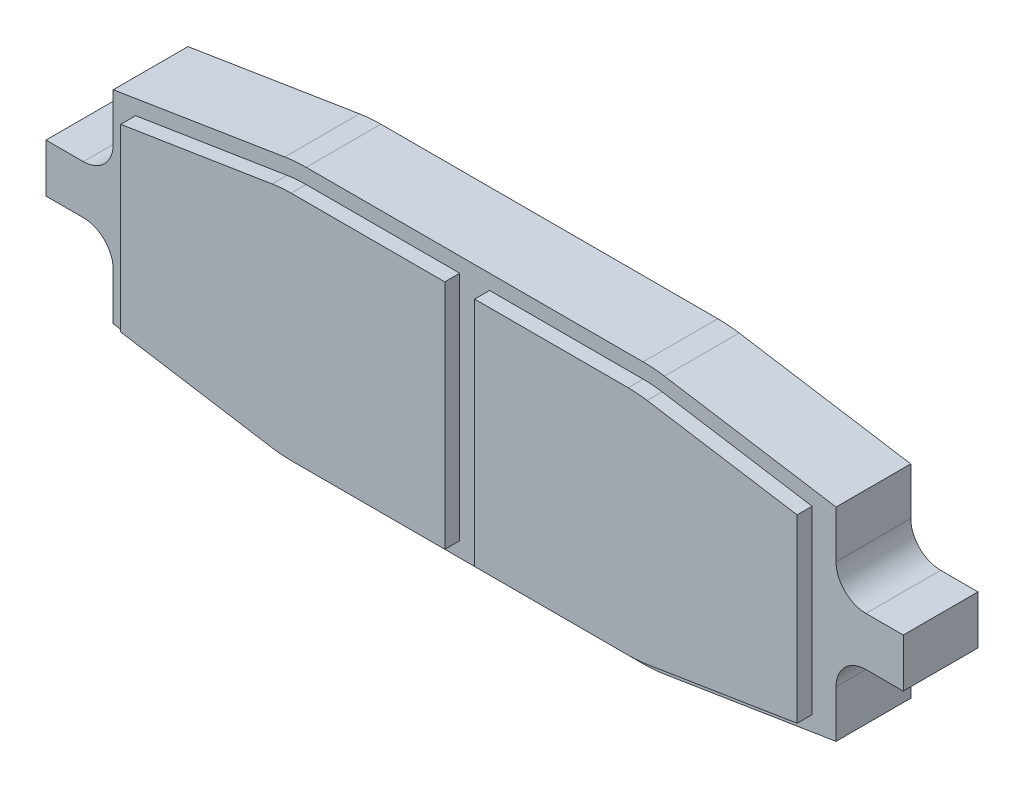
from build123d import *

# Parameters (mm, degrees)
BOSS_EXTRUDE1_DEPTH = 10
BOSS_EXTRUDE2_DEPTH = 2


with BuildPart() as part:
    # Sketch1 → Boss-Extrude1 (new body)
    with BuildSketch(Plane.XY):
        with BuildLine():
            Line((-52.370168415, -5.10038319), (-57.370168415, -5.10038319))
            Line((-57.370168415, -5.10038319), (-57.370168415, 1.39961681))
            Line((-57.370168415, 1.39961681), (-52.370168415, 1.39961681))
            ThreePointArc((-52.370168415, 1.39961681), (-49.54174129, 2.571189685), (-48.370168415, 5.39961681))
            Line((-48.370168415, 5.39961681), (-48.370168415, 11.733421381))
            Line((-48.370168415, 11.733421381), (-25.403732634, 15.421876122))
            ThreePointArc((-25.403732634, 15.421876122), (-23.981138375, 15.592591307), (-22.549472845, 15.64961681))
            Line((-22.549472845, 15.64961681), (22.549472845, 15.64961681))
            ThreePointArc((22.549472845, 15.64961681), (23.981138375, 15.592591307), (25.403732634, 15.421876122))
            Line((25.403732634, 15.421876122), (48.370168415, 11.733421381))
            Line((48.370168415, 11.733421381), (48.370168415, 5.39961681))
            ThreePointArc((48.370168415, 5.39961681), (49.54174129, 2.571189685), (52.370168415, 1.39961681))
            Line((52.370168415, 1.39961681), (57.370168415, 1.39961681))
            Line((57.370168415, 1.39961681), (57.370168415, -5.10038319))
            Line((57.370168415, -5.10038319), (52.370168415, -5.10038319))
            ThreePointArc((52.370168415, -5.10038319), (49.54174129, -6.271956065), (48.370168415, -9.10038319))
            Line((48.370168415, -9.10038319), (48.370168415, -15.434187761))
            Line((48.370168415, -15.434187761), (25.403732634, -19.122642502))
            ThreePointArc((25.403732634, -19.122642502), (23.981138375, -19.293357687), (22.549472845, -19.35038319))
            Line((22.549472845, -19.35038319), (-22.549472845, -19.35038319))
            ThreePointArc((-22.549472845, -19.35038319), (-23.980404824, -19.293416202), (-25.402279482, -19.12287582))
            Line((-25.402279482, -19.12287582), (-48.370168415, -15.398566029))
            Line((-48.370168415, -15.398566029), (-48.370168415, -9.10038319))
            ThreePointArc((-48.370168415, -9.10038319), (-49.54174129, -6.271956065), (-52.370168415, -5.10038319))
        make_face()
    extrude(amount=BOSS_EXTRUDE1_DEPTH)

    # Sketch2 → Boss-Extrude2 (add)
    with BuildSketch(Plane.XY.offset(10)):
        with BuildLine():
            Line((-2, 13.64961681), (-2, -17.35038319))
            Line((-2, -17.35038319), (-22.549472845, -17.35038319))
            ThreePointArc((-22.549472845, -17.35038319), (-23.820641613, -17.299807316), (-25.083774072, -17.148399435))
            Line((-25.083774072, -17.148399435), (-45.370168415, -13.858901767))
            Line((-45.370168415, -13.858901767), (-45.370168415, 10.222487605))
            Line((-45.370168415, 10.222487605), (-25.088107898, 13.446937218))
            ThreePointArc((-25.088107898, 13.446937218), (-23.82282933, 13.598866424), (-22.549472845, 13.64961681))
            Line((-22.549472845, 13.64961681), (-2, 13.64961681))
        make_face()
        with BuildLine():
            Line((2, 13.64961681), (2, -17.35038319))
            Line((2, -17.35038319), (22.549472845, -17.35038319))
            ThreePointArc((22.549472845, -17.35038319), (23.822336045, -17.29967218), (25.087130721, -17.14786059))
            Line((25.087130721, -17.14786059), (45.165381948, -13.934476775))
            Line((45.165381948, -13.934476775), (45.165381948, 10.222487605))
            Line((45.165381948, 10.222487605), (25.086592657, 13.447180643))
            ThreePointArc((25.086592657, 13.447180643), (23.822064428, 13.598927474), (22.549472845, 13.64961681))
            Line((22.549472845, 13.64961681), (2, 13.64961681))
        make_face()
    extrude(amount=BOSS_EXTRUDE2_DEPTH)


solid = part.part
